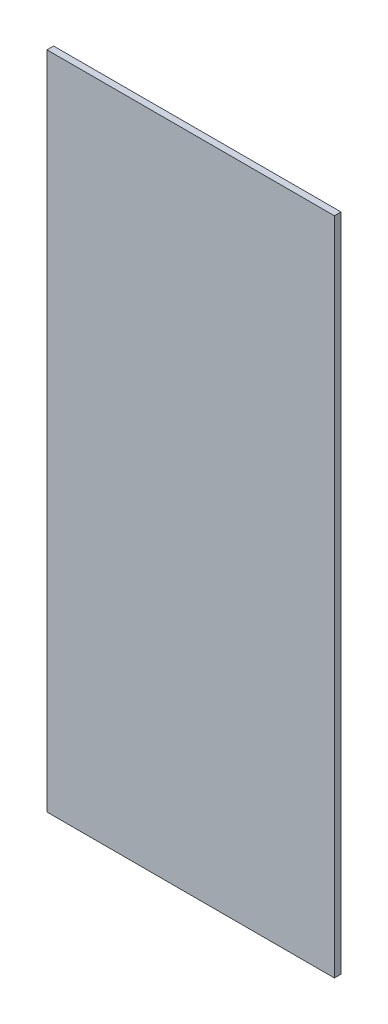
from build123d import *

# Parameters (mm, degrees)
SKETCH_1_W      = 347
SKETCH_1_H      = 797
EXTRUDE_1_DEPTH = 8


with BuildPart() as part:
    # 草图1 → 凸台-拉伸1 (new body)
    with BuildSketch(Plane.XY):
        with Locations((-2616, 2645.04375)):
            Rectangle(SKETCH_1_W, SKETCH_1_H)
    extrude(amount=EXTRUDE_1_DEPTH)


solid = part.part
